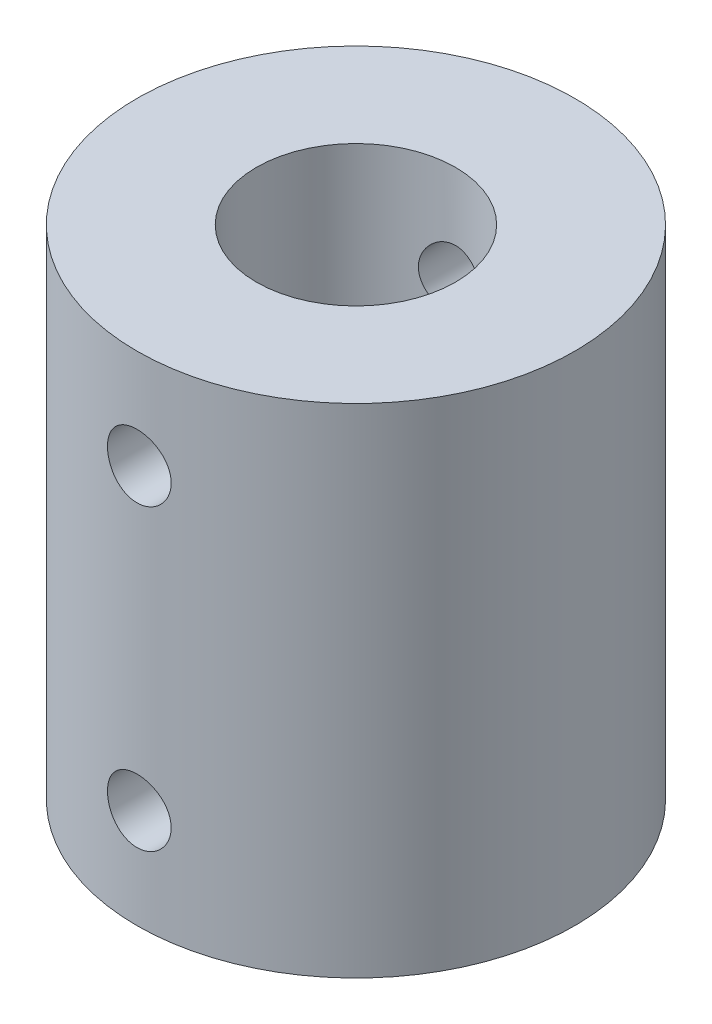
from build123d import *

# Parameters (mm, degrees)
SKETCH_1_R          = 11
SKETCH_1_R_2        = 5
EXTRUDE_1_DEPTH     = 12.5
SKETCH_2_R          = 1.6
CUT_EXTRUDE_1_DEPTH = 12.5


with BuildPart() as part:
    # ｽｹｯﾁ1 → ﾎﾞｽ - 押し出し1 (new, symmetric)
    with BuildSketch(Plane(origin=(0, 0, 0), x_dir=(1, 0, 0), z_dir=(0, 1, 0))):
        with Locations(Location((0, 0, 0), (0, 0, 270))):
            Circle(SKETCH_1_R)
        with Locations(Location((0, 0, 0), (0, 0, 270))):
            Circle(SKETCH_1_R_2, mode=Mode.SUBTRACT)
    extrude(amount=EXTRUDE_1_DEPTH, both=True)

    # ｽｹｯﾁ2 → ｶｯﾄ - 押し出し1 (cut, symmetric)
    with BuildSketch(Plane.XY):
        with Locations((0, 7.5)):
            Circle(SKETCH_2_R)
        with Locations((0, -7.5)):
            Circle(SKETCH_2_R)
    extrude(amount=CUT_EXTRUDE_1_DEPTH, both=True, mode=Mode.SUBTRACT)


solid = part.part
